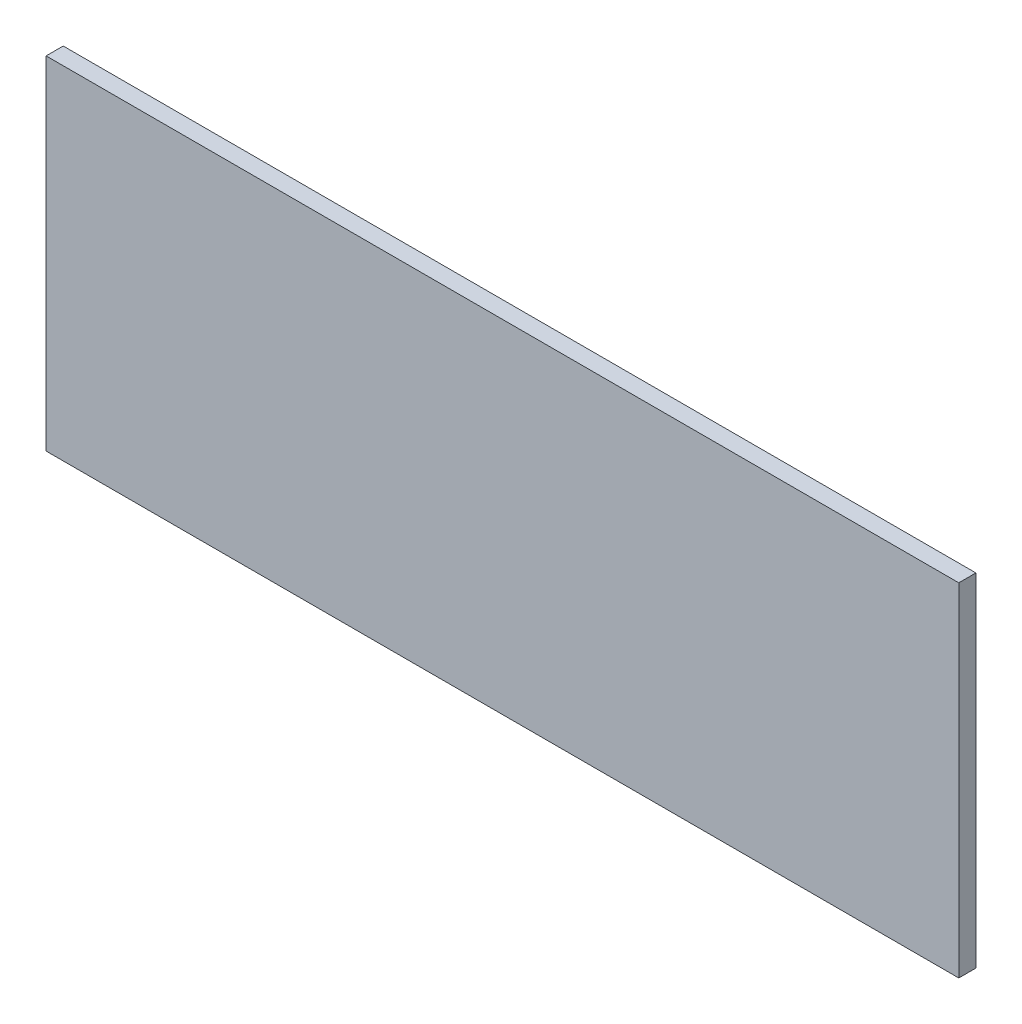
from build123d import *

# Parameters (mm, degrees)
ESQUISSE1_W        = 320
ESQUISSE1_H        = 120
BOSS_EXTRU_1_DEPTH = 6


with BuildPart() as part:
    # Esquisse1 → Boss.-Extru.1 (new body)
    with BuildSketch(Plane.XY):
        Rectangle(ESQUISSE1_W, ESQUISSE1_H)
    extrude(amount=BOSS_EXTRU_1_DEPTH)


solid = part.part
